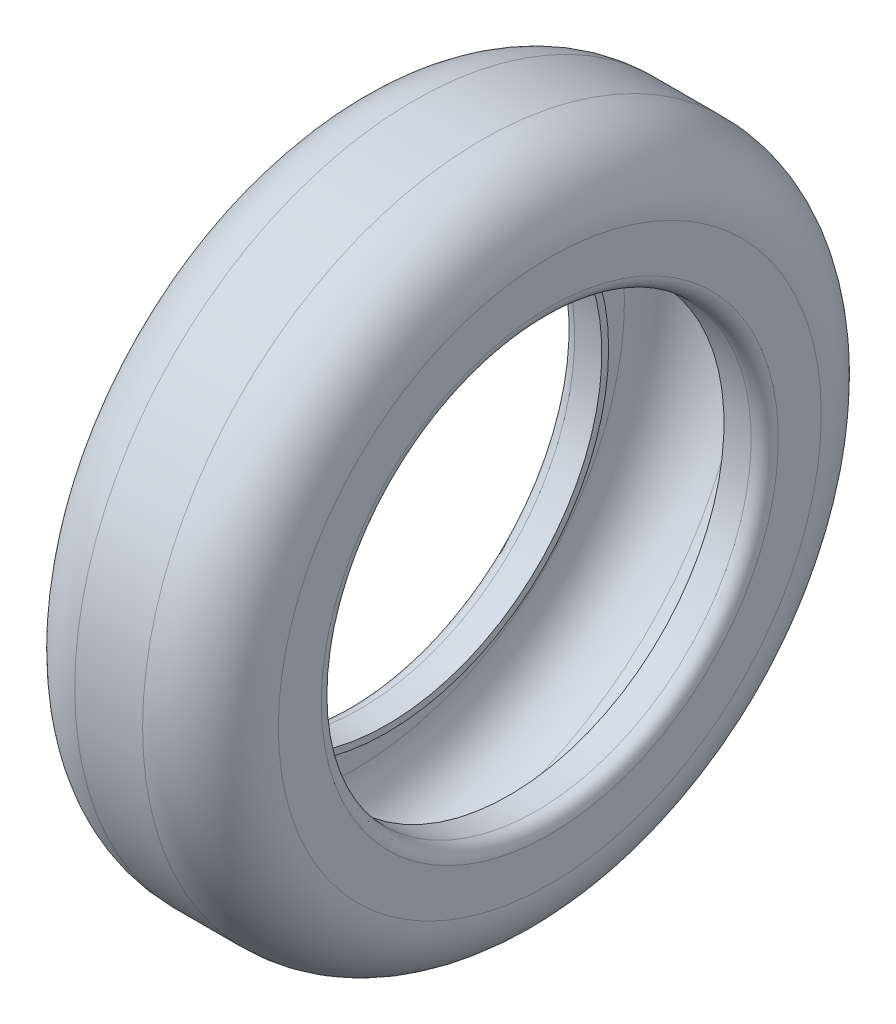
from build123d import *


with BuildPart() as part:
    # Sketch2 → Revolve2 (revolve)
    with BuildSketch(Plane.XY, mode=Mode.PRIVATE) as revolve2_sk:
        with BuildLine():
            Line((-45, 158.348486101), (-65, 158.348486101))
            ThreePointArc((-65, 158.348486101), (-72.071067812, 161.277418289), (-75, 168.348486101))
            Line((-75, 168.348486101), (-75, 200))
            ThreePointArc((-75, 200), (-60.355339059, 235.355339059), (-25, 250))
            Line((-25, 250), (25, 250))
            ThreePointArc((25, 250), (60.355339059, 235.355339059), (75, 200))
            Line((75, 200), (75, 168.348486101))
            ThreePointArc((75, 168.348486101), (72.071067812, 161.277418289), (65, 158.348486101))
            Line((65, 158.348486101), (45, 158.348486101))
            Line((45, 158.348486101), (45, 163.348486101))
            Line((45, 163.348486101), (65, 163.348486101))
            ThreePointArc((65, 163.348486101), (68.535533906, 164.812952195), (70, 168.348486101))
            Line((70, 168.348486101), (70, 200))
            ThreePointArc((70, 200), (56.819805153, 231.819805153), (25, 245))
            Line((25, 245), (-25, 245))
            ThreePointArc((-25, 245), (-56.819805153, 231.819805153), (-70, 200))
            Line((-70, 200), (-70, 168.348486101))
            ThreePointArc((-70, 168.348486101), (-68.535533906, 164.812952195), (-65, 163.348486101))
            Line((-65, 163.348486101), (-45, 163.348486101))
            Line((-45, 163.348486101), (-45, 158.348486101))
        make_face()
    revolve(revolve2_sk.sketch.rotate(Axis((-45, 0, 0), (1, 0, 0)), 90), axis=Axis((-45, 0, 0), (1, 0, 0)))


solid = part.part
